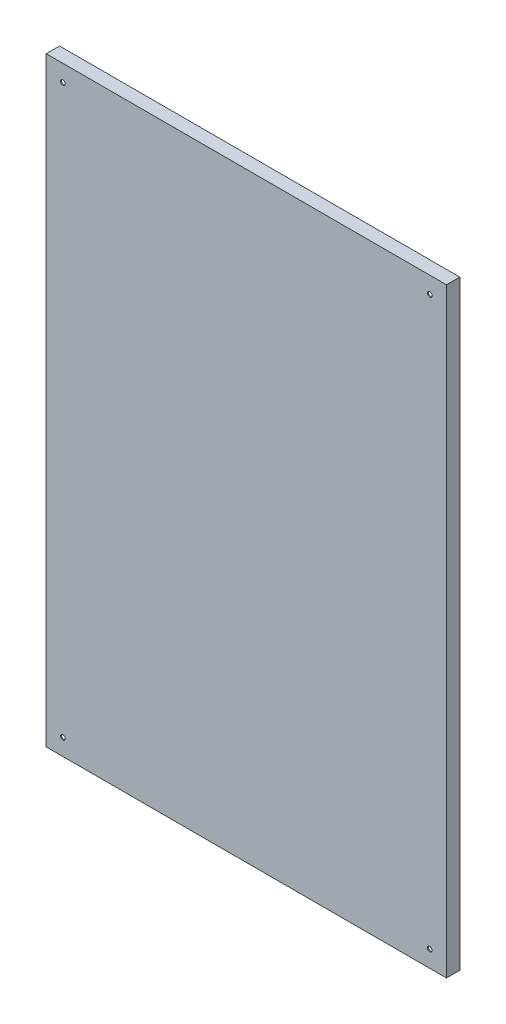
from build123d import *

# Parameters (mm, degrees)
SKETCH_1_W          = 600
SKETCH_1_H          = 900
EXTRUDE_1_DEPTH     = 1.5
SKETCH_2_W          = 600
SKETCH_2_H          = 900
SKETCH_2_W_2        = 597
SKETCH_2_H_2        = 897
EXTRUDE_2_DEPTH     = 18.5
SKETCH_4_R          = 3.5
CUT_EXTRUDE_1_DEPTH = 10


with BuildPart() as part:
    # 草图1 → 凸台-拉伸1 (new body)
    with BuildSketch(Plane.XY):
        Rectangle(SKETCH_1_W, SKETCH_1_H)
    extrude(amount=EXTRUDE_1_DEPTH)

    # 草图2 → 凸台-拉伸2 (add)
    with BuildSketch(Plane(origin=(0, 0, 0), x_dir=(-1, 0, 0), z_dir=(0, 0, -1))):
        Rectangle(SKETCH_2_W, SKETCH_2_H)
        Rectangle(SKETCH_2_W_2, SKETCH_2_H_2, mode=Mode.SUBTRACT)
    extrude(amount=EXTRUDE_2_DEPTH)

    # 草图4 → 切除-拉伸1 (cut)
    with BuildSketch(Plane.XY.offset(1.5)):
        with Locations((-275, 425)):
            Circle(SKETCH_4_R)
        with Locations((275, 425)):
            Circle(SKETCH_4_R)
        with Locations((-275, -425)):
            Circle(SKETCH_4_R)
        with Locations((275, -425)):
            Circle(SKETCH_4_R)
    extrude(amount=-CUT_EXTRUDE_1_DEPTH, mode=Mode.SUBTRACT)


solid = part.part
